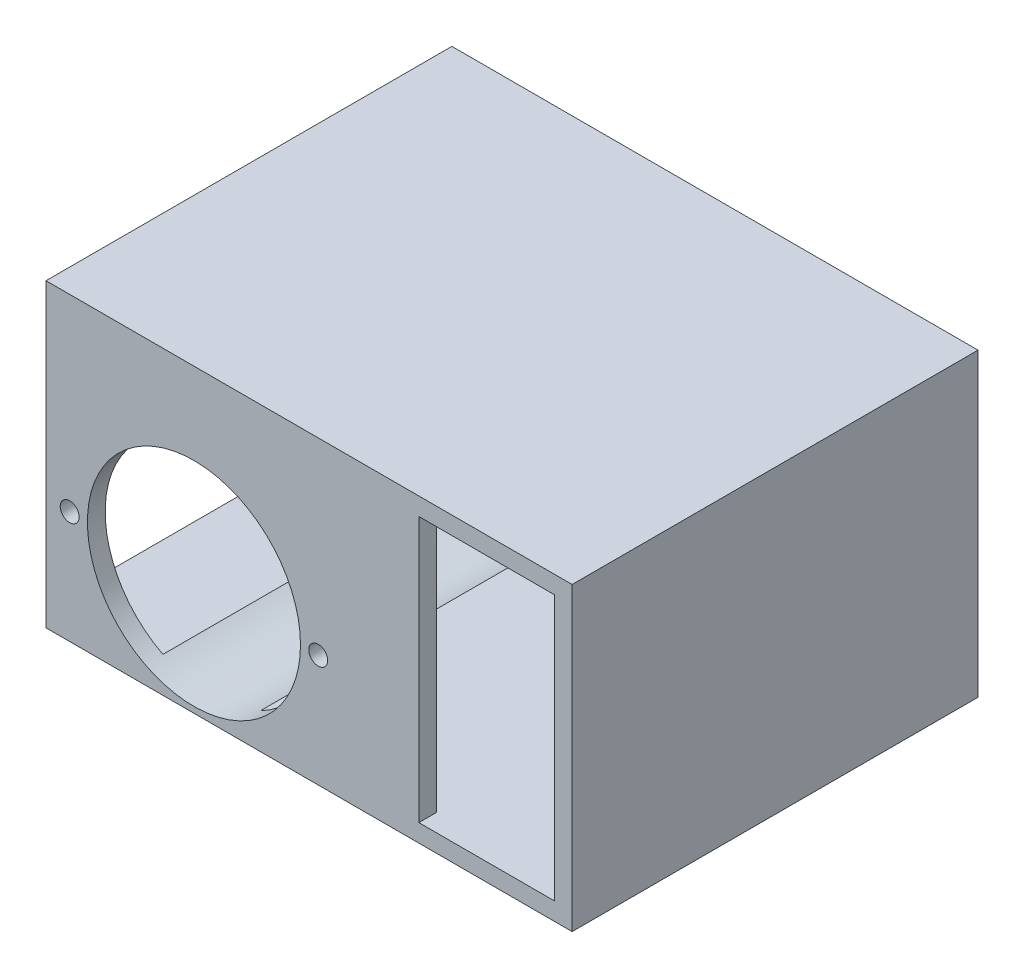
from build123d import *

# Parameters (mm, degrees)
SKETCH1_W           = 88.9
SKETCH1_H           = 50.8
BOSS_EXTRUDE1_DEPTH = 68.58
SHELL10_T           = 3
SKETCH2_R           = 18
SKETCH2_R_2         = 1.6
SKETCH2_W           = 22.9
SKETCH2_H           = 44.8
CUT_EXTRUDE1_DEPTH  = 69
SKETCH4_W           = 62.58
SKETCH4_H           = 44.8
CUT_EXTRUDE2_DEPTH  = 10


with BuildPart() as part:
    # Sketch1 → Boss-Extrude1 (new body)
    with BuildSketch(Plane.XY):
        with Locations((44.45, 25.4)):
            Rectangle(SKETCH1_W, SKETCH1_H)
    extrude(amount=BOSS_EXTRUDE1_DEPTH)

    # Shell10 (no face opened: a closed hollow body)
    add(offset(amount=-SHELL10_T, mode=Mode.PRIVATE), mode=Mode.SUBTRACT)

    # Sketch2 → Cut-Extrude1 (cut)
    with BuildSketch(Plane.XY.offset(68.58)):
        with Locations((25, 19)):
            Circle(SKETCH2_R)
        with Locations((4, 19)):
            Circle(SKETCH2_R_2)
        with Locations(Location((46, 19, 0), (0, 0, 180))):
            Circle(SKETCH2_R_2)
        with Locations((74.45, 25.4)):
            Rectangle(SKETCH2_W, SKETCH2_H)
    extrude(amount=-CUT_EXTRUDE1_DEPTH, mode=Mode.SUBTRACT)

    # Sketch4 → Cut-Extrude2 (cut)
    with BuildSketch(Plane.ZY):
        with Locations((34.29, 25.4)):
            Rectangle(SKETCH4_W, SKETCH4_H)
    extrude(amount=-CUT_EXTRUDE2_DEPTH, mode=Mode.SUBTRACT)


solid = part.part
